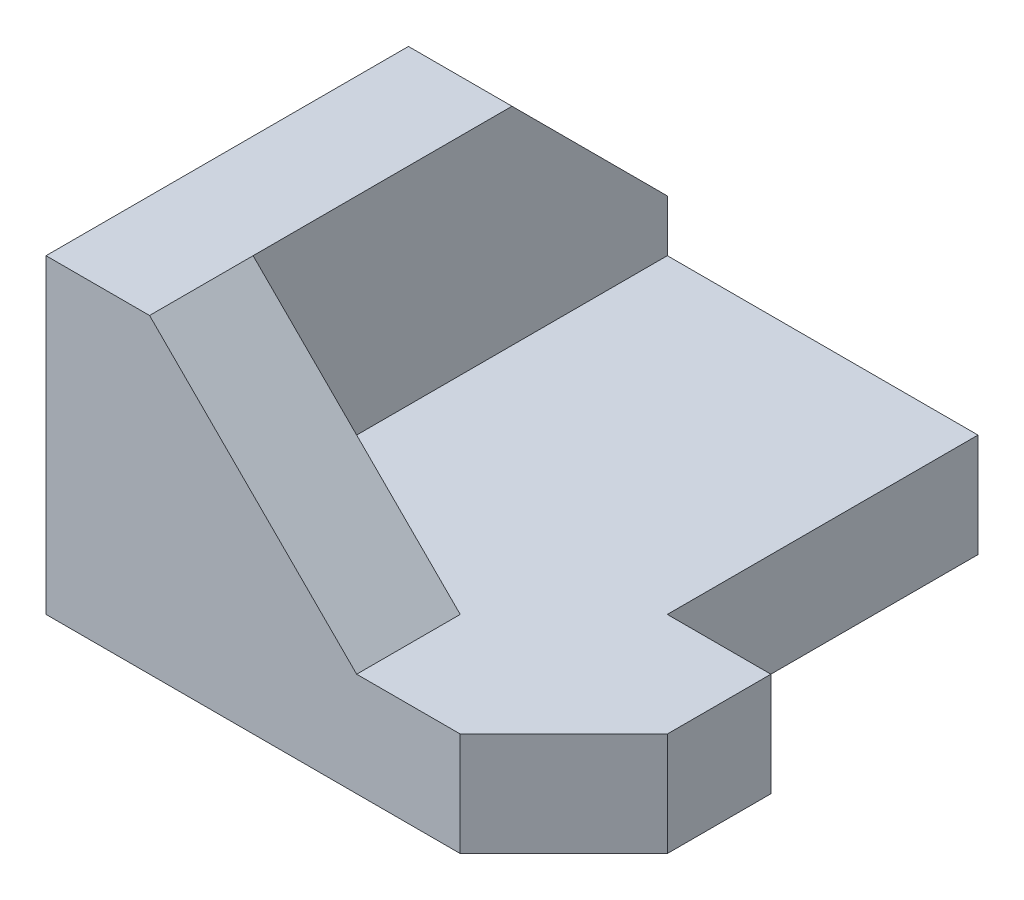
from build123d import *

# Parameters (mm, degrees)
SKETCH1_W           = 10
SKETCH1_H           = 50
BOSS_EXTRUDE1_DEPTH = 30
BOSS_EXTRUDE2_DEPTH = 10
CHAMFER1_SIZE       = 10
CHAMFER2_SIZE       = 15
BOSS_EXTRUDE3_DEPTH = 10


with BuildPart() as part:
    # Sketch1 → Boss-Extrude1 (new body)
    with BuildSketch(Plane(origin=(0, 0, 0), x_dir=(1, 0, 0), z_dir=(0, 1, 0))):
        with Locations((5, 25)):
            Rectangle(SKETCH1_W, SKETCH1_H)
    extrude(amount=BOSS_EXTRUDE1_DEPTH)

    # Sketch1<3> → Boss-Extrude2 (add)
    with BuildSketch(Plane(origin=(0, 0, 0), x_dir=(1, 0, 0), z_dir=(0, 1, 0))):
        Polygon((10, 50), (10, 0), (50, 0), (50, 20), (40, 20), (40, 50), align=None)
    extrude(amount=BOSS_EXTRUDE2_DEPTH)

    # Chamfer1
    chamfer1_edges = [part.edges().sort_by_distance(p)[0] for p in [
        (50, 5, 0),
    ]]
    chamfer(chamfer1_edges, length=CHAMFER1_SIZE)

    # Chamfer2
    chamfer2_edges = [part.edges().sort_by_distance(p)[0] for p in [
        (5, 30, -50),
    ]]
    chamfer(chamfer2_edges, length=CHAMFER2_SIZE)

    # Sketch2 → Boss-Extrude3 (add)
    with BuildSketch(Plane.XY):
        Polygon((10, 10), (30, 10), (10, 30), align=None)
    extrude(amount=-BOSS_EXTRUDE3_DEPTH)


solid = part.part
